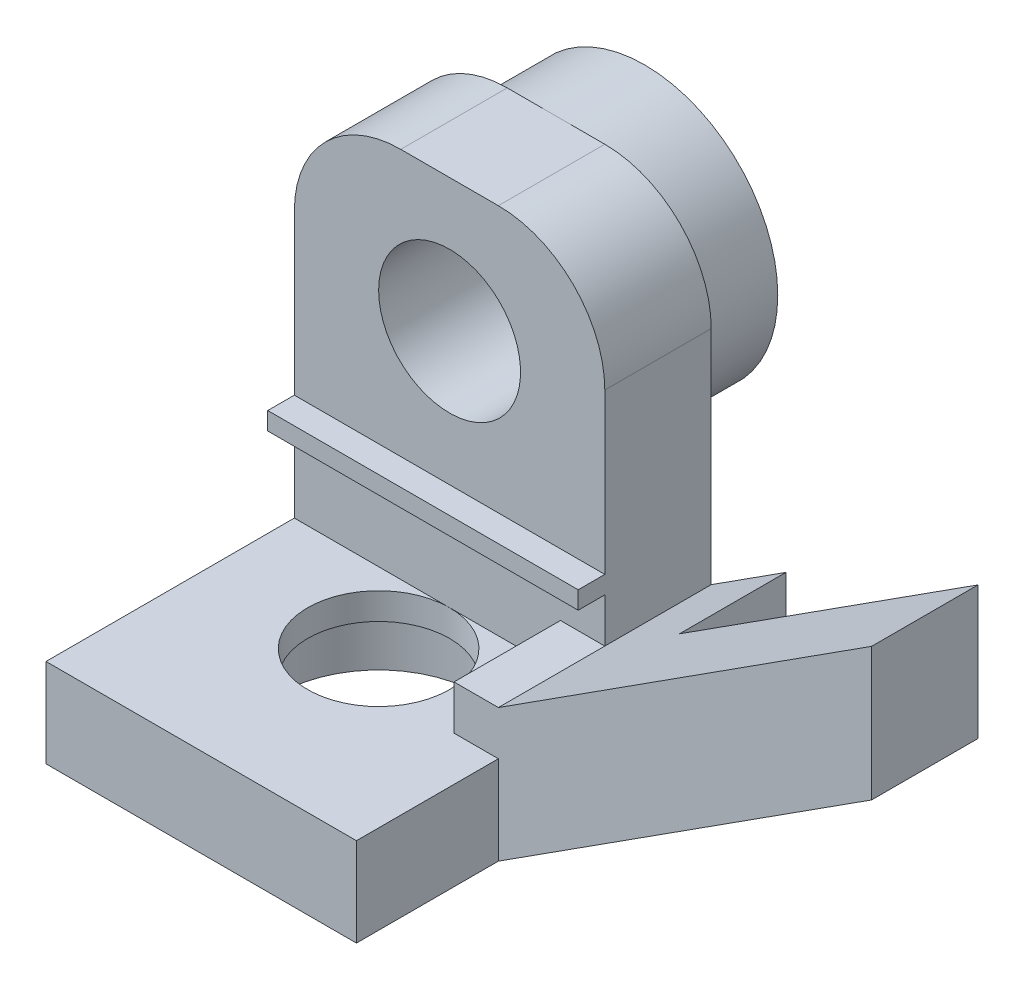
from build123d import *

# Parameters (mm, degrees)
SKETCH1_W           = 35
SKETCH1_H           = 12
BOSS_EXTRUDE1_DEPTH = 20
SKETCH2_W           = 35
SKETCH2_H           = 12
BOSS_EXTRUDE2_DEPTH = 10
CUT_EXTRUDE1_DEPTH  = 12
FILLET1_R           = 12
SKETCH5_R           = 15
SKETCH5_R_2         = 12
BOSS_EXTRUDE3_DEPTH = 10
SKETCH6_W           = 35
SKETCH6_H           = 15
BOSS_EXTRUDE4_DEPTH = 2
SKETCH7_W           = 35
SKETCH7_H           = 12
BOSS_EXTRUDE5_DEPTH = 10
SKETCH8_W           = 35
SKETCH8_H           = 40
BOSS_EXTRUDE6_DEPTH = 10
SKETCH10_R          = 11.2
CUT_EXTRUDE2_DEPTH  = 7
SKETCH11_R          = 8
CUT_EXTRUDE3_DEPTH  = 3
BOSS_EXTRUDE7_DEPTH = 12
BOSS_EXTRUDE8_DEPTH = 12
SKETCH14_W          = 12
SKETCH14_H          = 5
BOSS_EXTRUDE9_DEPTH = 5


with BuildPart() as part:
    # Sketch1 → Boss-Extrude1 (new body)
    with BuildSketch(Plane(origin=(0, 0, 0), x_dir=(1, 0, 0), z_dir=(0, 1, 0))):
        Rectangle(SKETCH1_W, SKETCH1_H)
    extrude(amount=BOSS_EXTRUDE1_DEPTH)

    # Sketch2 → Boss-Extrude2 (add)
    with BuildSketch(Plane(origin=(0, 20, 0), x_dir=(1, 0, 0), z_dir=(0, 1, 0))):
        Rectangle(SKETCH2_W, SKETCH2_H)
    extrude(amount=BOSS_EXTRUDE2_DEPTH)

    # Sketch4 → Cut-Extrude1 (cut)
    with BuildSketch(Plane(origin=(0, 0, -6), x_dir=(-1, 0, 0), z_dir=(0, 0, -1))):
        with BuildLine():
            ThreePointArc((8, 15), (0, 23), (-8, 15))
            Line((-8, 15), (8, 15))
        make_face()
        with BuildLine():
            Line((8, 15), (-8, 15))
            ThreePointArc((-8, 15), (0, 7), (8, 15))
        make_face()
    extrude(amount=-CUT_EXTRUDE1_DEPTH, mode=Mode.SUBTRACT)

    # Fillet1
    fillet1_edges = [part.edges().sort_by_distance(p)[0] for p in [
        (-17.5, 30, 0),
        (17.5, 30, 0),
    ]]
    fillet(fillet1_edges, radius=FILLET1_R)

    # Sketch5 → Boss-Extrude3 (add)
    with BuildSketch(Plane(origin=(0, 0, -6), x_dir=(-1, 0, 0), z_dir=(0, 0, -1))):
        with Locations(Location((0, 15, 0), (0, 0, 270))):
            Circle(SKETCH5_R)
        with Locations((0, 15)):
            Circle(SKETCH5_R_2, mode=Mode.SUBTRACT)
    extrude(amount=BOSS_EXTRUDE3_DEPTH)

    # Sketch6 → Boss-Extrude4 (add)
    with BuildSketch(Plane.XZ):
        with Locations((0, 1.5)):
            Rectangle(SKETCH6_W, SKETCH6_H)
    extrude(amount=BOSS_EXTRUDE4_DEPTH)

    # Sketch7 → Boss-Extrude5 (add)
    with BuildSketch(Plane.XZ.offset(2)):
        Rectangle(SKETCH7_W, SKETCH7_H)
    extrude(amount=BOSS_EXTRUDE5_DEPTH)

    # Sketch8 → Boss-Extrude6 (add)
    with BuildSketch(Plane.XZ.offset(12)):
        with Locations((0, 14)):
            Rectangle(SKETCH8_W, SKETCH8_H)
    extrude(amount=BOSS_EXTRUDE6_DEPTH)

    # Sketch10 → Cut-Extrude2 (cut)
    with BuildSketch(Plane.XZ.offset(22)):
        with Locations(Location((0, 14, 0), (0, 0, 270))):
            Circle(SKETCH10_R)
    extrude(amount=-CUT_EXTRUDE2_DEPTH, mode=Mode.SUBTRACT)

    # Sketch11 → Cut-Extrude3 (cut)
    with BuildSketch(Plane.XZ.offset(15)):
        with Locations(Location((0, 14, 0), (0, 0, 270))):
            Circle(SKETCH11_R)
    extrude(amount=-CUT_EXTRUDE3_DEPTH, mode=Mode.SUBTRACT)

    # Sketch12 → Boss-Extrude7 (add)
    with BuildSketch(Plane(origin=(0, 0, -6), x_dir=(-1, 0, 0), z_dir=(0, 0, -1))):
        Polygon((-17.5, -22), (-25.915107819, -16.597596795), (-25.915107819, -1.597596795), (-17.5, -7), align=None)
    extrude(amount=-BOSS_EXTRUDE7_DEPTH)

    # Sketch13 → Boss-Extrude8 (add)
    with BuildSketch(Plane.XY.offset(6)):
        Polygon((17.5, -22), (17.5, -7), (59.575539097, 20.012016024), (59.575539097, 5.012016024), align=None)
    extrude(amount=BOSS_EXTRUDE8_DEPTH)

    # Sketch14 → Boss-Extrude9 (add)
    with BuildSketch(Plane.ZY.offset(-17.5)):
        with Locations((12, -9.5)):
            Rectangle(SKETCH14_W, SKETCH14_H)
    extrude(amount=BOSS_EXTRUDE9_DEPTH)


solid = part.part
